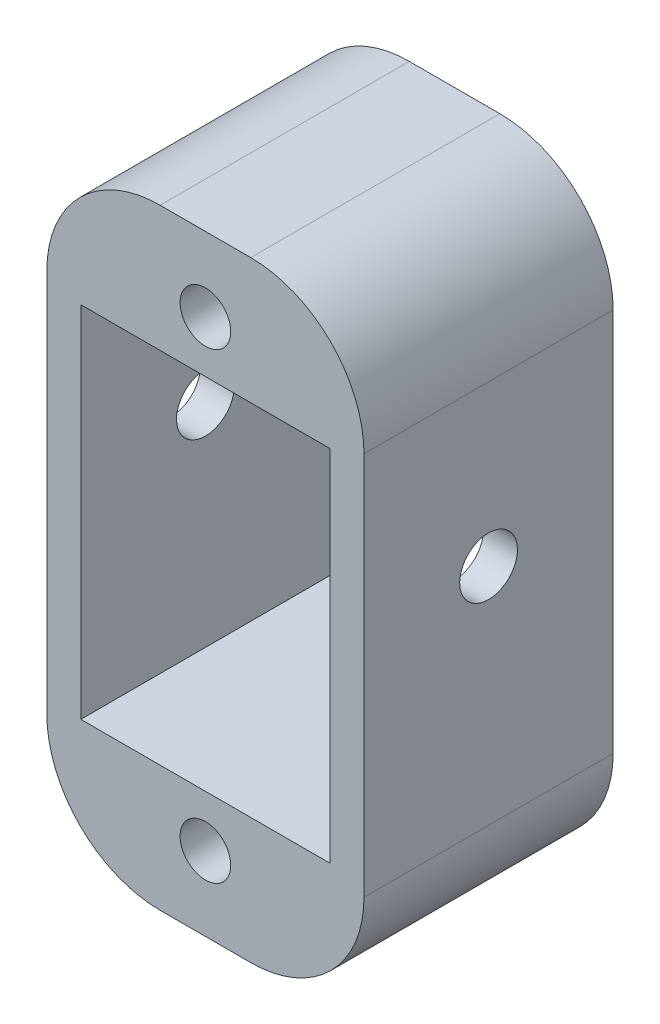
from build123d import *

# Parameters (mm, degrees)
SKETCH_2_W               = 22
SKETCH_2_H               = 31.71
EXTRUDE_1_DEPTH          = 22
SKETCH_1_R               = 2.235222544
CUT_EXTRUDE_1_DEPTH      = 38.979461569
CUT_EXTRUDE_2_DEPTH      = 46.024794997
CUT_EXTRUDE_2_DEPTH_BACK = 46.024794997
SKETCH_3_R               = 2.55


with BuildPart() as part:
    # Эскиз2 → Бобышка-Вытянуть1 (new body)
    with BuildSketch(Plane.XY):
        with BuildLine():
            Line((-4.114082915, 26.355832174), (3.885917085, 26.355832174))
            ThreePointArc((3.885917085, 26.355832174), (10.956984897, 23.426899986), (13.885917085, 16.355832174))
            Line((13.885917085, 16.355832174), (13.885917085, -17.554167826))
            ThreePointArc((13.885917085, -17.554167826), (10.956984897, -24.625235638), (3.885917085, -27.554167826))
            Line((3.885917085, -27.554167826), (-4.114082915, -27.554167826))
            ThreePointArc((-4.114082915, -27.554167826), (-11.185150727, -24.625235638), (-14.114082915, -17.554167826))
            Line((-14.114082915, -17.554167826), (-14.114082915, 16.355832174))
            ThreePointArc((-14.114082915, 16.355832174), (-11.185150727, 23.426899986), (-4.114082915, 26.355832174))
        make_face()
        with Locations((-0.114082915, -0.599167826)):
            Rectangle(SKETCH_2_W, SKETCH_2_H, mode=Mode.SUBTRACT)
    extrude(amount=EXTRUDE_1_DEPTH)

    # Эскиз1 → Вырез-Вытянуть1 (cut, through all)
    with BuildSketch(Plane.XY):
        with Locations((-0.114082915, 19.805832174)):
            Circle(SKETCH_1_R)
        with Locations((-0.114082915, -21.004167826)):
            Circle(SKETCH_1_R)
    extrude(amount=CUT_EXTRUDE_1_DEPTH, mode=Mode.SUBTRACT)

    # Эскиз3 → Вырез-Вытянуть2 (cut, two sides: drawn at the far end of the back side and taken through both)
    with BuildSketch(Plane(origin=(13.885917085, 0, 0), x_dir=(0, 0, -1), z_dir=(1, 0, 0)).offset(-CUT_EXTRUDE_2_DEPTH_BACK)):
        with Locations(Location((-11, 2.255832174, 0), (0, 0, 270))):
            Circle(SKETCH_3_R)
    extrude(amount=CUT_EXTRUDE_2_DEPTH + CUT_EXTRUDE_2_DEPTH_BACK, mode=Mode.SUBTRACT)


solid = part.part
